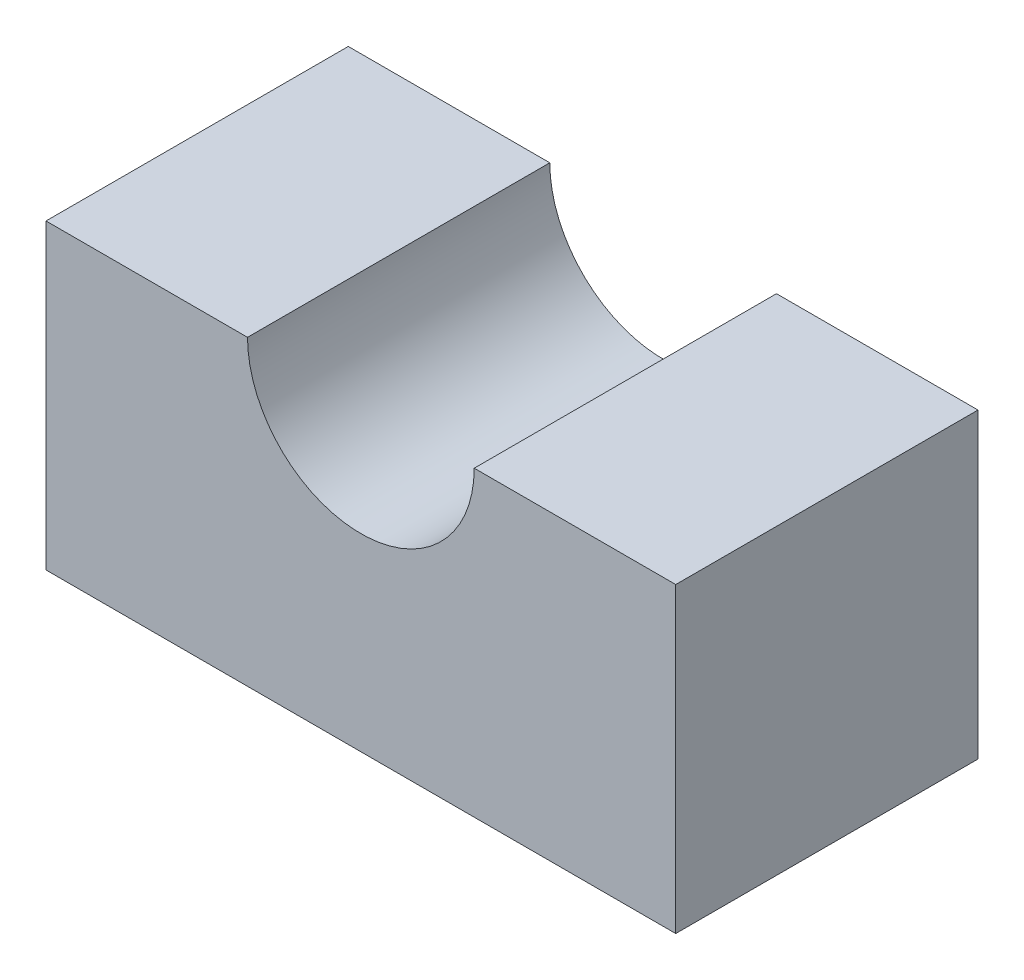
from build123d import *

# Parameters (mm, degrees)
BOSS_EXTRUDE1_DEPTH = 6


with BuildPart() as part:
    # Sketch1 → Boss-Extrude1 (new, symmetric)
    with BuildSketch(Plane.XY):
        with BuildLine():
            Line((-12.5, 0), (12.5, 0))
            Line((12.5, 0), (12.5, 12))
            Line((12.5, 12), (4.5, 12))
            ThreePointArc((4.5, 12), (0, 7.5), (-4.5, 12))
            Line((-4.5, 12), (-12.5, 12))
            Line((-12.5, 12), (-12.5, 0))
        make_face()
    extrude(amount=BOSS_EXTRUDE1_DEPTH, both=True)


solid = part.part
